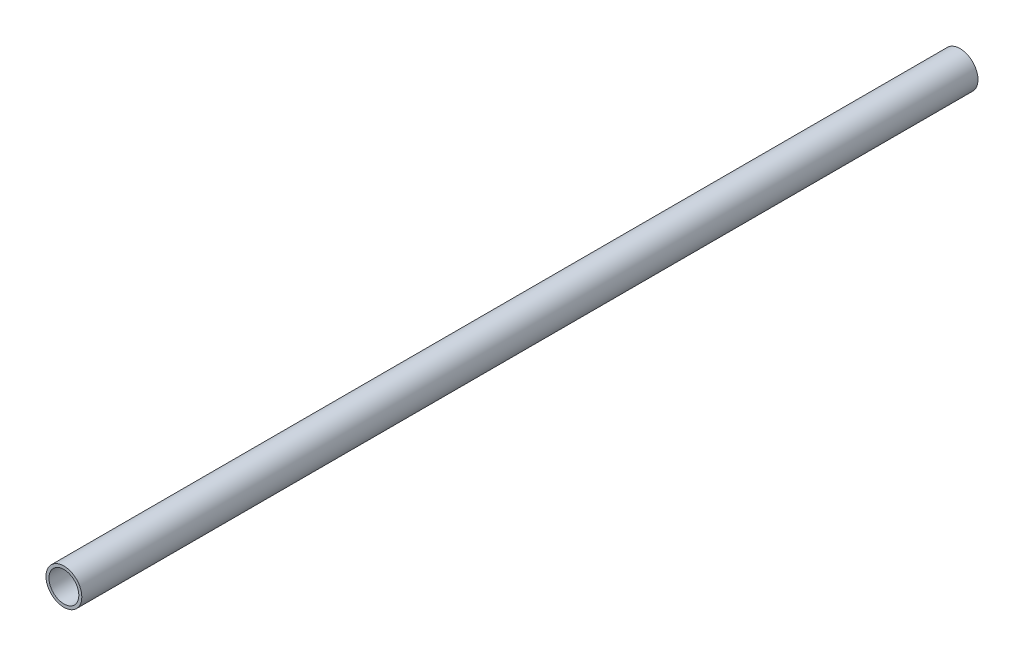
from build123d import *

# Parameters (mm, degrees)
SKETCH1_R           = 6
SKETCH1_R_2         = 5
BOSS_EXTRUDE1_DEPTH = 300


with BuildPart() as part:
    # Sketch1 → Boss-Extrude1 (new body)
    with BuildSketch(Plane.XY):
        Circle(SKETCH1_R)
        Circle(SKETCH1_R_2, mode=Mode.SUBTRACT)
    extrude(amount=BOSS_EXTRUDE1_DEPTH)


solid = part.part
